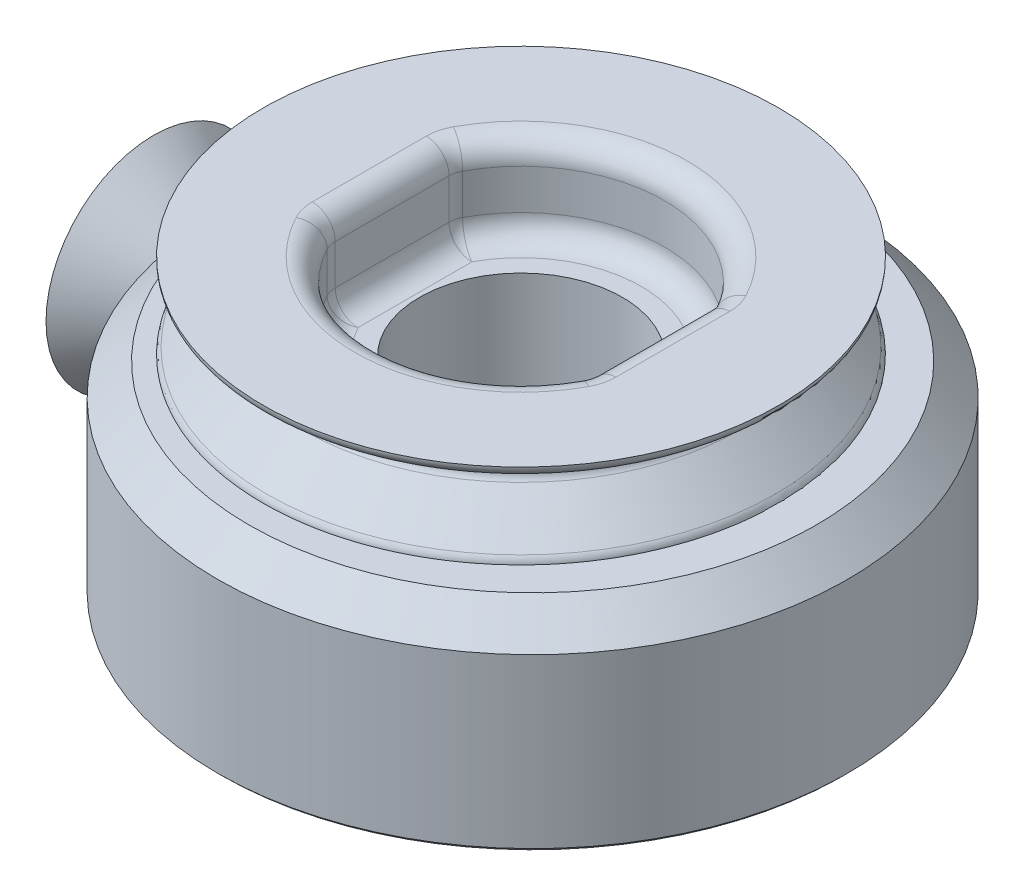
from build123d import *

# Parameters (mm, degrees)
SKETCH1_R               = 34.925
SKETCH1_R_2             = 23.8125
BOSS_EXTRUDE1_DEPTH     = 11.2395
CHAMFER1_SIZE           = 2.159
CHAMFER2_SIZE           = 3.4798000000000004
CHAMFER3_SIZE           = 0.381
CHAMFER4_SIZE           = 1.27
BOSS_EXTRUDE2_DEPTH     = 11.112499999999999
CUT_EXTRUDE1_DEPTH      = 60.304470691571126
CUT_EXTRUDE1_DEPTH_BACK = 60.304470691571126
SKETCH4_R               = 11.25000000000001
FILLET1_R               = 3.3019999999999996
CUT_EXTRUDE3_DEPTH      = 6.35
SKETCH7_R               = 28.575000000000006
BOSS_EXTRUDE3_DEPTH     = 9.525
FILLET2_R               = 2.54
FILLET3_R               = 0.8


with BuildPart() as part:
    # Sketch1 → Boss-Extrude1 (new, symmetric)
    with BuildSketch(Plane(origin=(0, 0, 0), x_dir=(1, 0, 0), z_dir=(0, 1, 0))):
        Circle(SKETCH1_R)
        Circle(SKETCH1_R_2, mode=Mode.SUBTRACT)
    extrude(amount=BOSS_EXTRUDE1_DEPTH, both=True)

    # Chamfer1
    chamfer1_edges = [part.edges().sort_by_distance(p)[0] for p in [
        (-23.8125, -11.2395, -2.92e-15),
        (-23.8125, 11.2395, -2.92e-15),
    ]]
    chamfer(chamfer1_edges, length=CHAMFER1_SIZE)

    # Chamfer2
    chamfer2_edges = [part.edges().sort_by_distance(p)[0] for p in [
        (-34.925, 11.2395, -4.28e-15),
    ]]
    chamfer(chamfer2_edges, length=CHAMFER2_SIZE)

    # Chamfer3
    chamfer3_edges = [part.edges().sort_by_distance(p)[0] for p in [
        (-34.925, -11.2395, -4.28e-15),
    ]]
    chamfer(chamfer3_edges, length=CHAMFER3_SIZE)

    # Sketch2 → Revolve1 (revolve)
    with BuildSketch(Plane(origin=(0, 0, 0), x_dir=(1, 0, 0), z_dir=(0, 1, 0))):
        Polygon((-42.03699999999999, 11.9126), (-42.03699999999999, 0), (-17.11959999999999, 0), (-17.11959999999999, 5.369303693380148), (-34.5097986497785, 5.369303693380146), align=None)
    revolve(axis=Axis((-42.03699999999999, 0, 0), (1, 0, 0)))

    # Chamfer4
    chamfer4_edges = [part.edges().sort_by_distance(p)[0] for p in [
        (-17.11959999999999, -1.73e-15, 5.369303693380148),
    ]]
    chamfer(chamfer4_edges, length=CHAMFER4_SIZE)

    # Sketch6 → Cut-Extrude3 (cut)
    with BuildSketch(Plane.ZY.offset(42.03699999999999)):
        Polygon((-4.619379503786196, 1.7e-15), (-2.3096897518931003, -4.000500000000001), (2.3096897518930977, -4.000499999999999), (4.619379503786196, 2.98e-15), (2.3096897518931, 4.000500000000001), (-2.3096897518930986, 4.0005000000000015), align=None)
    extrude(amount=-CUT_EXTRUDE3_DEPTH, mode=Mode.SUBTRACT)


with BuildPart() as body_2:
    # Sketch3 → Boss-Extrude2 (new, symmetric)
    with BuildSketch(Plane(origin=(0, 0, 0), x_dir=(1, 0, 0), z_dir=(0, 1, 0))):
        with BuildLine():
            Line((-22.950221267996525, 6.350000000000001), (-16.450221267996525, 6.350000000000001))
            Line((-16.450221267996525, 6.350000000000001), (-16.450221267996525, -6.349999999999998))
            Line((-16.450221267996525, -6.349999999999998), (-22.950221267996525, -6.350000000000001))
            ThreePointArc((-22.950221267996525, -6.350000000000001), (23.8125, 0), (-22.950221267996525, 6.350000000000001))
        make_face()
    extrude(amount=BOSS_EXTRUDE2_DEPTH, both=True)

    # Sketch4 → Cut-Extrude1 (cut, two sides: drawn at the far end of the back side and taken through both)
    with BuildSketch(Plane(origin=(0, 11.112499999999999, 0), x_dir=(1, 0, 0), z_dir=(0, 1, 0)).offset(-CUT_EXTRUDE1_DEPTH_BACK)):
        with Locations((-1.28929384, 0)):
            Circle(SKETCH4_R)
    extrude(amount=CUT_EXTRUDE1_DEPTH + CUT_EXTRUDE1_DEPTH_BACK, mode=Mode.SUBTRACT)

    # Fillet1
    fillet1_edges = [body_2.edges().sort_by_distance(p)[0] for p in [
        (-16.450221267996525, 0, 6.349999999999998),
        (-16.450221267996525, 0, -6.350000000000001),
    ]]
    fillet(fillet1_edges, radius=FILLET1_R)

    # Sketch7 → Boss-Extrude3 (add)
    with BuildSketch(Plane(origin=(0, 11.112499999999999, 0), x_dir=(1, 0, 0), z_dir=(0, 1, 0))):
        with Locations((-1.28929384, 0)):
            Circle(SKETCH7_R)
        with BuildLine():
            Line((-15.57679384, 6.919752072870816), (-15.57679384, -6.919752072870816))
            ThreePointArc((-15.57679384, -6.919752072870816), (-1.2892938400000025, -15.875), (12.998206159999999, -6.919752072870816))
            Line((12.998206159999999, -6.919752072870816), (12.998206159999999, 6.919752072870816))
            ThreePointArc((12.998206159999999, 6.919752072870816), (-1.2892938400000025, 15.874999999999996), (-15.57679384, 6.919752072870816))
        make_face(mode=Mode.SUBTRACT)
    extrude(amount=BOSS_EXTRUDE3_DEPTH)

    # Fillet2
    fillet2_edges = [body_2.edges().sort_by_distance(p)[0] for p in [
        (12.998206159999999, 20.6375, 0),
        (12.998206159999999, 11.112499999999999, 0),
        (12.998206159999999, 15.875, 6.919752072870814),
        (-1.2892938399999991, 20.6375, 15.875),
        (-1.2892938399999991, 11.112499999999999, 15.875),
        (-15.57679384, 15.875, 6.919752072870816),
        (-15.57679384, 20.6375, 0),
        (-15.57679384, 11.112499999999999, 0),
        (-15.57679384, 15.875, -6.919752072870815),
        (-1.2892938400000014, 20.6375, -15.874999999999996),
        (12.998206159999999, 15.875, -6.919752072870816),
        (-1.2892938400000014, 11.112499999999999, -15.874999999999996),
    ]]
    fillet(fillet2_edges, radius=FILLET2_R)

    # Sketch9 → Cut-Revolve1 (revolve, cut)
    with BuildSketch(Plane.XY):
        with BuildLine():
            Line((-29.864293840000006, 20.6375), (-29.864293840000006, 11.112499999999999))
            ThreePointArc((-29.864293840000006, 11.112499999999999), (-29.77294927700148, 11.571720113180088), (-29.51282197742386, 11.96102812690827))
            Line((-29.51282197742386, 11.96102812690827), (-25.439110399046303, 16.034739705285816))
            ThreePointArc((-25.439110399046303, 16.034739705285816), (-25.089440006432948, 17.169735104085216), (-25.830882004619195, 18.0975))
            Line((-25.830882004619195, 18.0975), (-29.14264408239436, 19.536963292024634))
            ThreePointArc((-29.14264408239436, 19.536963292024634), (-29.667792791387903, 19.979480353968526), (-29.864293840000006, 20.6375))
        make_face()
    revolve(axis=Axis((-1.28929384, 9.73306284018895, 0), (0, 1, 0)), mode=Mode.SUBTRACT)

    # Fillet3
    fillet3_edges = [body_2.edges().sort_by_distance(p)[0] for p in [
        (-22.950221267996525, 0, -6.350000000000003),
        (-22.950221267996525, 0, 6.350000000000001),
    ]]
    fillet(fillet3_edges, radius=FILLET3_R)


solid = Compound([part.part, body_2.part])
